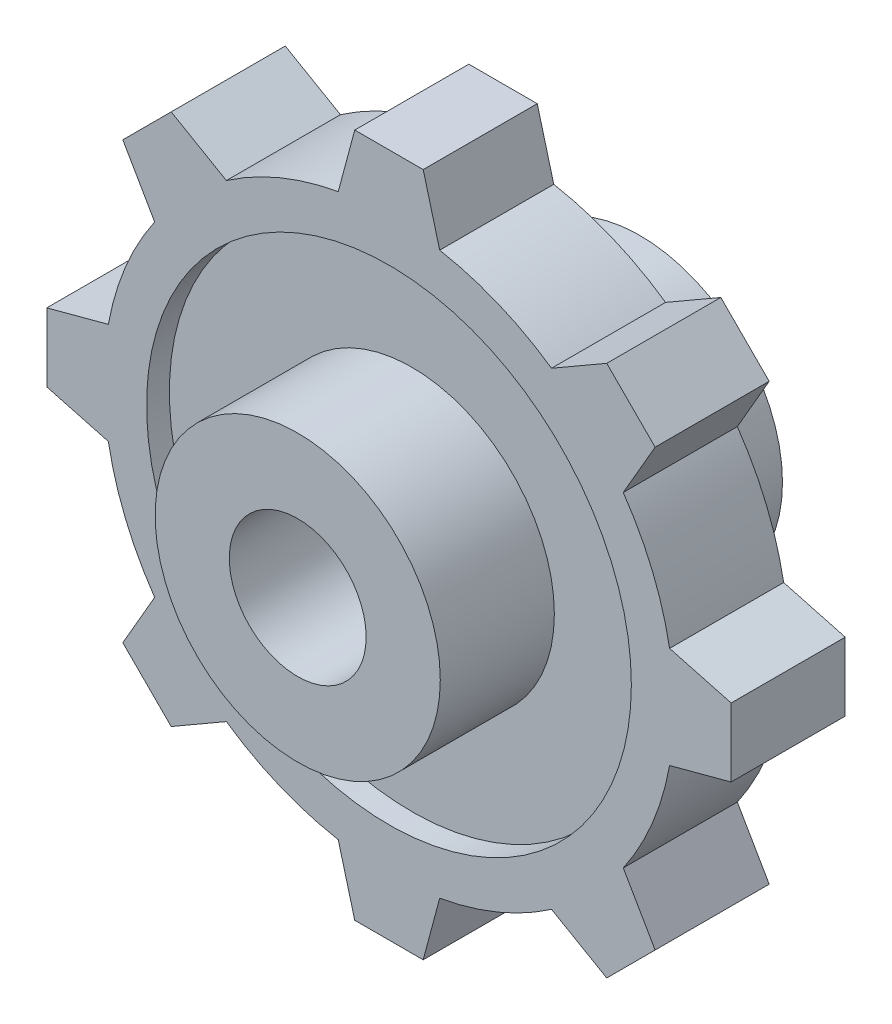
from build123d import *

# Parameters (mm, degrees)
SKETCH1_R           = 25
EXTRUDE1_DEPTH      = 10
EXTRUDE2_DEPTH      = 10
CIRPATTERN1_COUNT   = 8
SKETCH3_R           = 21.25
CUT_EXTRUDE1_DEPTH  = 2
EXTRUDE3_DEPTH      = 10
EXTRUDE3_DEPTH_BACK = 20
SKETCH4_R           = 12.5
SKETCH4_R_2         = 6


with BuildPart() as part:
    # Sketch1 → Extrude1 (new body)
    with BuildSketch(Plane.XY):
        Circle(SKETCH1_R)
    extrude(amount=EXTRUDE1_DEPTH)

    # Sketch2 → Extrude2 (add)
    with BuildSketch(Plane.XY.offset(10)):
        Polygon((-3, 30), (3, 30), (5.679491924, 20), (-5.679491924, 20), align=None)
    extrude2 = extrude(amount=-EXTRUDE2_DEPTH)

    # CirPattern1: Extrude2 ×8 about axis
    cirpattern1_axis = Axis((0, 0, 0), (0, 0, 1))
    for i in range(1, CIRPATTERN1_COUNT):
        add(extrude2.rotate(cirpattern1_axis, i * 360 / CIRPATTERN1_COUNT))

    # Sketch3 → Cut-Extrude1 (cut)
    with BuildSketch(Plane.XY.offset(10)):
        Circle(SKETCH3_R)
    extrude(amount=-CUT_EXTRUDE1_DEPTH, mode=Mode.SUBTRACT)

    # Sketch4 → Extrude3 (add, two sides: drawn at the far end of the back side and taken through both)
    with BuildSketch(Plane.XY.offset(8).offset(-EXTRUDE3_DEPTH_BACK)):
        Circle(SKETCH4_R)
        Circle(SKETCH4_R_2, mode=Mode.SUBTRACT)
    extrude(amount=EXTRUDE3_DEPTH + EXTRUDE3_DEPTH_BACK)


solid = part.part
